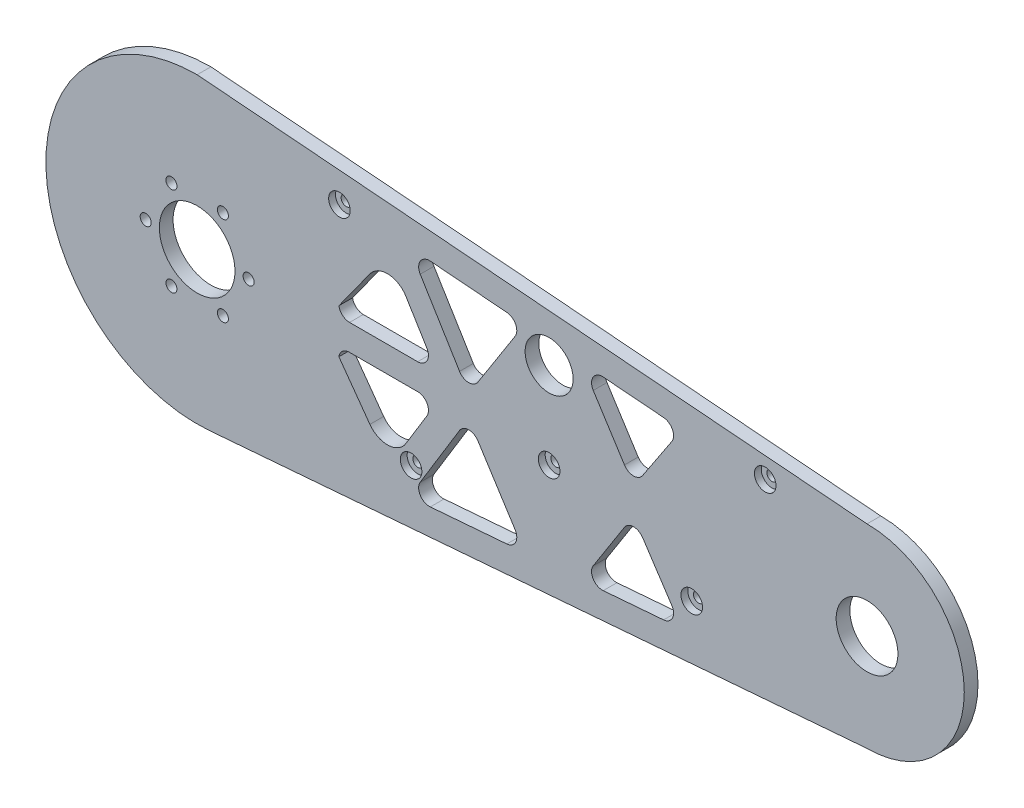
from build123d import *

# Parameters (mm, degrees)
SKETCH1_R             = 14.29385
SKETCH1_R_2           = 11.1125
BOSS_EXTRUDE1_DEPTH   = 6.35
CROQUIS1_R            = 2.38125
CORTAR_EXTRUIR1_DEPTH = 50
CROQUIS2_R            = 5
CORTAR_EXTRUIR2_DEPTH = 3.175
CROQUIS4_R            = 5
CORTAR_EXTRUIR3_DEPTH = 3.175
CROQUIS5_R            = 2.38125
CORTAR_EXTRUIR5_DEPTH = 10
CROQUIS6_R            = 2.38125
CORTAR_EXTRUIR6_DEPTH = 10
CROQUIS7_R            = 5
CORTAR_EXTRUIR7_DEPTH = 3.17
CROQUIS8_R            = 17.5
CORTAR_EXTRUIR8_DEPTH = 10
CROQUIS9_R            = 2.5527
CORTAR_EXTRUIR9_DEPTH = 10


with BuildPart() as part:
    # Sketch1 → Boss-Extrude1 (new body)
    with BuildSketch(Plane.XY):
        with BuildLine():
            Line((0, 70), (310, 45))
            ThreePointArc((310, 45), (355, 0), (310, -45))
            Line((310, -45), (5.171398252, -69.808714643))
            ThreePointArc((5.171398252, -69.808714643), (-69.952162315, -2.587467389), (0, 70))
        make_face()
        Circle(SKETCH1_R, mode=Mode.SUBTRACT)
        with Locations((310, 0)):
            Circle(SKETCH1_R, mode=Mode.SUBTRACT)
        with Locations((162.878542763, 35)):
            Circle(SKETCH1_R_2, mode=Mode.SUBTRACT)
        with BuildLine():
            Line((107.898974887, 49.259511156), (143.314248041, 46.40344074))
            ThreePointArc((143.314248041, 46.40344074), (147.389908855, 43.644764005), (147.127454118, 38.730252238))
            Line((147.127454118, 38.730252238), (129.916226305, 11.754586611))
            ThreePointArc((129.916226305, 11.754586611), (125.651076231, 9.444205574), (121.433006579, 11.839462159))
            Line((121.433006579, 11.839462159), (103.228961238, 41.671198203))
            ThreePointArc((103.228961238, 41.671198203), (103.238833139, 46.896293531), (107.898974887, 49.259511156))
        make_face(mode=Mode.SUBTRACT)
        with BuildLine():
            Line((70.523244027, 6), (102.03004784, 6))
            ThreePointArc((102.03004784, 6), (106.3902351, 8.552804247), (106.298140539, 13.604493178))
            Line((106.298140539, 13.604493178), (96.590354482, 29.513051181))
            ThreePointArc((96.590354482, 29.513051181), (88.437172177, 34.296727565), (79.941746192, 30.151166228))
            Line((79.941746192, 30.151166228), (65.58297828, 10.229432452))
            ThreePointArc((65.58297828, 10.229432452), (67.271539685, 7.201787411), (70.523244027, 6))
        make_face(mode=Mode.SUBTRACT)
        with BuildLine():
            Line((219.623774494, 32.810522613), (206.130928429, 12.417497436))
            ThreePointArc((206.130928429, 12.417497436), (201.919524559, 10.176643248), (197.745901529, 12.48710226))
            Line((197.745901529, 12.48710226), (183.296864227, 35.133505128))
            ThreePointArc((183.296864227, 35.133505128), (183.227765467, 40.400743015), (187.913912204, 42.80669363))
            Line((187.913912204, 42.80669363), (215.855795571, 40.553315939))
            ThreePointArc((215.855795571, 40.553315939), (219.949772588, 37.757395035), (219.623774494, 32.810522613))
        make_face(mode=Mode.SUBTRACT)
        with BuildLine():
            Line((96.590354482, -29.513051181), (106.298140539, -13.604493178))
            ThreePointArc((106.298140539, -13.604493178), (106.3902351, -8.552804247), (102.03004784, -6))
            Line((102.03004784, -6), (70.523244027, -6))
            ThreePointArc((70.523244027, -6), (67.271539685, -7.201787411), (65.58297828, -10.229432452))
            Line((65.58297828, -10.229432452), (79.941746192, -30.151166228))
            ThreePointArc((79.941746192, -30.151166228), (88.437172177, -34.296727565), (96.590354482, -29.513051181))
        make_face(mode=Mode.SUBTRACT)
        with BuildLine():
            Line((187.913912204, -42.80669363), (215.855795571, -40.553315939))
            ThreePointArc((215.855795571, -40.553315939), (219.949772588, -37.757395035), (219.623774494, -32.810522613))
            Line((219.623774494, -32.810522613), (206.130928429, -12.417497436))
            ThreePointArc((206.130928429, -12.417497436), (201.919524559, -10.176643248), (197.745901529, -12.48710226))
            Line((197.745901529, -12.48710226), (183.296864227, -35.133505128))
            ThreePointArc((183.296864227, -35.133505128), (183.227765467, -40.400743015), (187.913912204, -42.80669363))
        make_face(mode=Mode.SUBTRACT)
        with BuildLine():
            Line((121.433006579, -11.839462159), (103.228961238, -41.671198203))
            ThreePointArc((103.228961238, -41.671198203), (103.238833139, -46.896293531), (107.898974887, -49.259511156))
            Line((107.898974887, -49.259511156), (143.314248041, -46.40344074))
            ThreePointArc((143.314248041, -46.40344074), (147.389908855, -43.644764005), (147.127454118, -38.730252238))
            Line((147.127454118, -38.730252238), (129.916226305, -11.754586611))
            ThreePointArc((129.916226305, -11.754586611), (125.651076231, -9.444205574), (121.433006579, -11.839462159))
        make_face(mode=Mode.SUBTRACT)
    extrude(amount=BOSS_EXTRUDE1_DEPTH)

    # Croquis1 → Cortar-Extruir1 (cut)
    with BuildSketch(Plane.XY.offset(6.35)):
        with Locations((98.995555235, -37.090103176)):
            Circle(CROQUIS1_R)
        with Locations((228.877351461, -26.519571404)):
            Circle(CROQUIS1_R)
    extrude(amount=-CORTAR_EXTRUIR1_DEPTH, mode=Mode.SUBTRACT)

    # Croquis2 → Cortar-Extruir2 (cut)
    with BuildSketch(Plane.XY.offset(6.35)):
        with Locations((98.995555235, -37.090103176)):
            Circle(CROQUIS2_R)
        with Locations((228.877351461, -26.519571404)):
            Circle(CROQUIS2_R)
    extrude(amount=-CORTAR_EXTRUIR2_DEPTH, mode=Mode.SUBTRACT)

    # Croquis4 → Cortar-Extruir3 (cut)
    with BuildSketch(Plane.XY.offset(6.35)):
        with Locations((162.878542763, -5)):
            Circle(CROQUIS4_R)
    extrude(amount=-CORTAR_EXTRUIR3_DEPTH, mode=Mode.SUBTRACT)

    # Croquis5 → Cortar-Extruir5 (cut)
    with BuildSketch(Plane.XY.offset(6.35)):
        with Locations((162.878542763, -5)):
            Circle(CROQUIS5_R)
    extrude(amount=-CORTAR_EXTRUIR5_DEPTH, mode=Mode.SUBTRACT)

    # Croquis6 → Cortar-Extruir6 (cut)
    with BuildSketch(Plane.XY.offset(6.35)):
        with Locations((65.84135797, 50.868973694)):
            Circle(CROQUIS6_R)
        with Locations((262.871569637, 39.210126075)):
            Circle(CROQUIS6_R)
    extrude(amount=-CORTAR_EXTRUIR6_DEPTH, mode=Mode.SUBTRACT)

    # Croquis7 → Cortar-Extruir7 (cut)
    with BuildSketch(Plane.XY.offset(6.35)):
        with Locations((65.84135797, 50.868973694)):
            Circle(CROQUIS7_R)
        with Locations((262.871569637, 39.210126075)):
            Circle(CROQUIS7_R)
    extrude(amount=-CORTAR_EXTRUIR7_DEPTH, mode=Mode.SUBTRACT)

    # Croquis8 → Cortar-Extruir8 (cut)
    with BuildSketch(Plane.XY.offset(6.35)):
        Circle(CROQUIS8_R)
    extrude(amount=-CORTAR_EXTRUIR8_DEPTH, mode=Mode.SUBTRACT)

    # Croquis9 → Cortar-Extruir9 (cut)
    with BuildSketch(Plane(origin=(0, 0, 0), x_dir=(-1, 0, 0), z_dir=(0, 0, -1))):
        with Locations((23.8125, 0)):
            Circle(CROQUIS9_R)
        with Locations((11.90625, -20.622229928)):
            Circle(CROQUIS9_R)
        with Locations((-11.90625, -20.622229928)):
            Circle(CROQUIS9_R)
        with Locations((-23.8125, 0)):
            Circle(CROQUIS9_R)
        with Locations((-11.90625, 20.622229928)):
            Circle(CROQUIS9_R)
        with Locations((11.90625, 20.622229928)):
            Circle(CROQUIS9_R)
    extrude(amount=-CORTAR_EXTRUIR9_DEPTH, mode=Mode.SUBTRACT)


solid = part.part
